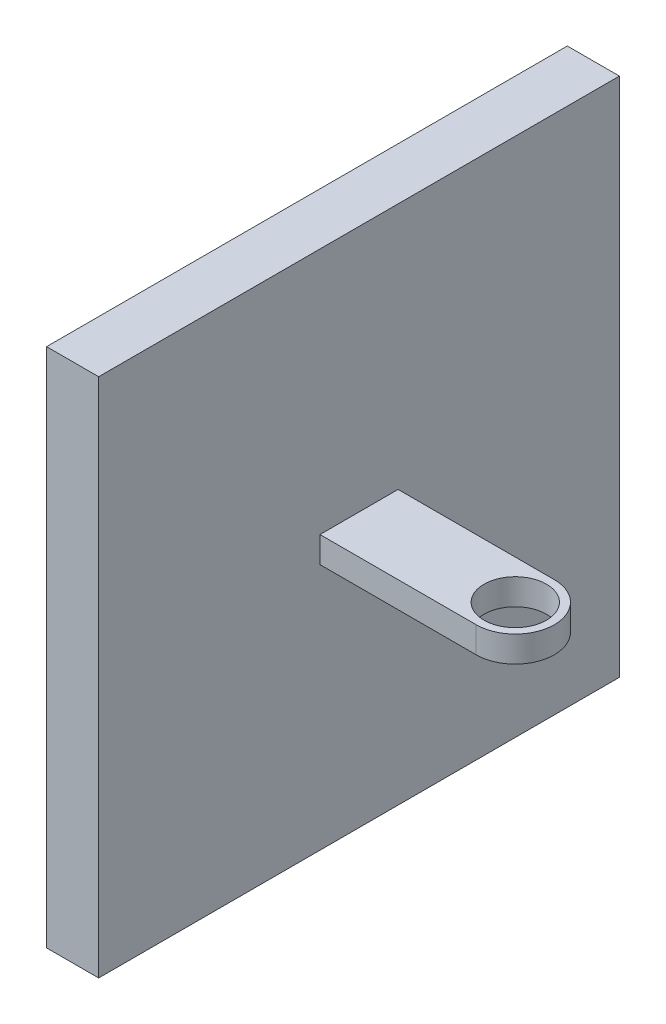
from build123d import *

# Parameters (mm, degrees)
SKETCH_1_W          = 10
SKETCH_1_H          = 10
EXTRUDE_1_DEPTH     = 1
SKETCH_2_W          = 1.5
SKETCH_2_H          = 0.5
EXTRUDE_2_DEPTH     = 8
CUT_EXTRUDE_2_DEPTH = 2
SKETCH_4_R          = 0.6
CUT_EXTRUDE_3_DEPTH = 2


with BuildPart() as part:
    # 草图1 → 凸台-拉伸1 (new body)
    with BuildSketch(Plane(origin=(0, 0, 0), x_dir=(0, 0, -1), z_dir=(1, 0, 0))):
        with Locations((5, 5)):
            Rectangle(SKETCH_1_W, SKETCH_1_H)
    extrude(amount=EXTRUDE_1_DEPTH)

    # 草图2 → 凸台-拉伸2 (add)
    with BuildSketch(Plane(origin=(1, 0, 0), x_dir=(0, 0, -1), z_dir=(1, 0, 0))):
        with Locations((5, 5)):
            Rectangle(SKETCH_2_W, SKETCH_2_H)
    extrude(amount=EXTRUDE_2_DEPTH)

    # 草图3 → 切除-拉伸2 (cut)
    with BuildSketch(Plane.XZ.offset(-4.75)):
        with BuildLine():
            Line((9, -4.25), (4, -4.25))
            ThreePointArc((4, -4.25), (4.75, -5), (4, -5.75))
            Line((4, -5.75), (9, -5.75))
            Line((9, -5.75), (9, -4.25))
        make_face()
    extrude(amount=-CUT_EXTRUDE_2_DEPTH, mode=Mode.SUBTRACT)

    # 草图4 → 切除-拉伸3 (cut)
    with BuildSketch(Plane.XZ.offset(-4.75)):
        with Locations(Location((4, -5, 0), (0, 0, 270))):
            Circle(SKETCH_4_R)
    extrude(amount=-CUT_EXTRUDE_3_DEPTH, mode=Mode.SUBTRACT)


solid = part.part
